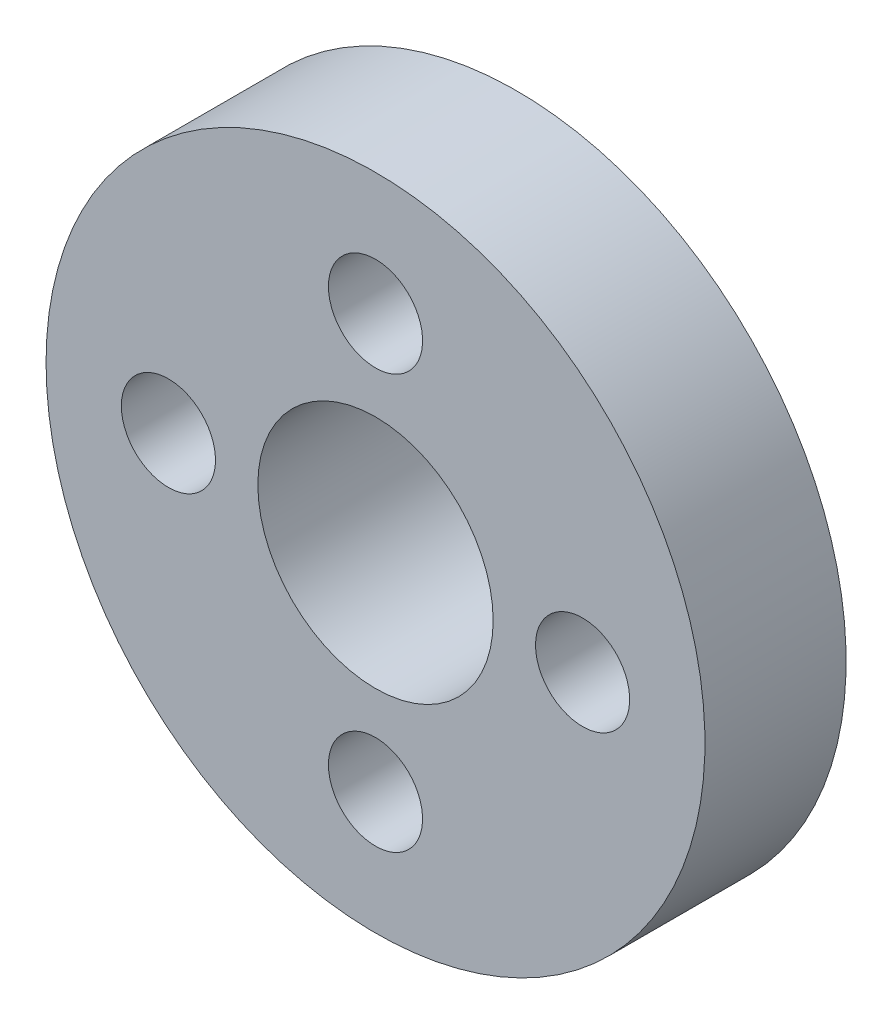
from build123d import *

# Parameters (mm, degrees)
SKETCH1_R           = 17.78
SKETCH1_R_2         = 2.54
SKETCH1_R_3         = 6.35
BOSS_EXTRUDE1_DEPTH = 7.62
BOSS_EXTRUDE2_START = 3.175
SKETCH2_W           = 16.51
SKETCH2_H           = 16.51
SKETCH2_R           = 6.35
BOSS_EXTRUDE2_DEPTH = 3.175


with BuildPart() as part:
    # Sketch1 → Boss-Extrude1 (new body)
    with BuildSketch(Plane.XY):
        with Locations(Location((0, 0, 0), (0, 0, 180))):
            Circle(SKETCH1_R)
        with Locations(Location((-11.176, 0, 0), (0, 0, 180))):
            Circle(SKETCH1_R_2, mode=Mode.SUBTRACT)
        with Locations(Location((0, -11.176, 0), (0, 0, 180))):
            Circle(SKETCH1_R_2, mode=Mode.SUBTRACT)
        with Locations(Location((11.176, 0, 0), (0, 0, 180))):
            Circle(SKETCH1_R_2, mode=Mode.SUBTRACT)
        with Locations(Location((0, 11.176, 0), (0, 0, 180))):
            Circle(SKETCH1_R_2, mode=Mode.SUBTRACT)
        with Locations(Location((0, 0, 0), (0, 0, 180))):
            Circle(SKETCH1_R_3, mode=Mode.SUBTRACT)
    extrude(amount=BOSS_EXTRUDE1_DEPTH)

    # Sketch2 → Boss-Extrude2 (add)
    with BuildSketch(Plane(origin=(0, 0, 0), x_dir=(-1, 0, 0), z_dir=(0, 0, -1)).offset(BOSS_EXTRUDE2_START)):
        Rectangle(SKETCH2_W, SKETCH2_H)
        Circle(SKETCH2_R, mode=Mode.SUBTRACT)
    extrude(amount=-BOSS_EXTRUDE2_DEPTH)


solid = part.part
